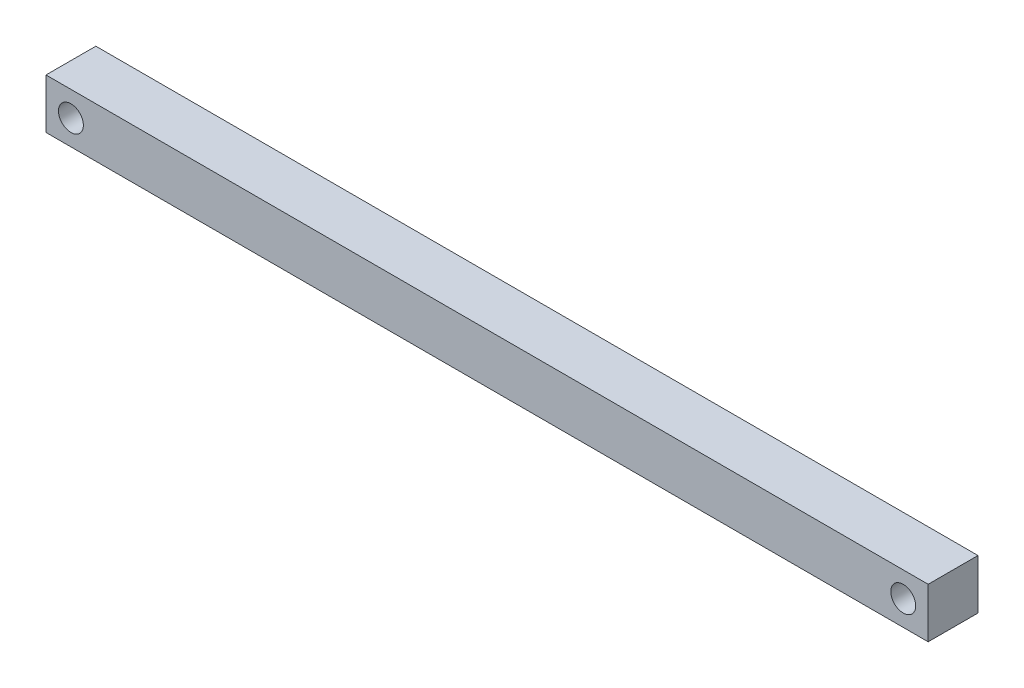
from build123d import *

# Parameters (mm, degrees)
SKETCH1_W           = 531
SKETCH1_H           = 30
SKETCH1_R           = 7.5
BOSS_EXTRUDE1_DEPTH = 15


with BuildPart() as part:
    # Sketch1 → Boss-Extrude1 (new, symmetric)
    with BuildSketch(Plane.XY):
        Rectangle(SKETCH1_W, SKETCH1_H)
        with Locations((-250.5, 0)):
            Circle(SKETCH1_R, mode=Mode.SUBTRACT)
        with Locations((250.5, 0)):
            Circle(SKETCH1_R, mode=Mode.SUBTRACT)
    extrude(amount=BOSS_EXTRUDE1_DEPTH, both=True)


solid = part.part
